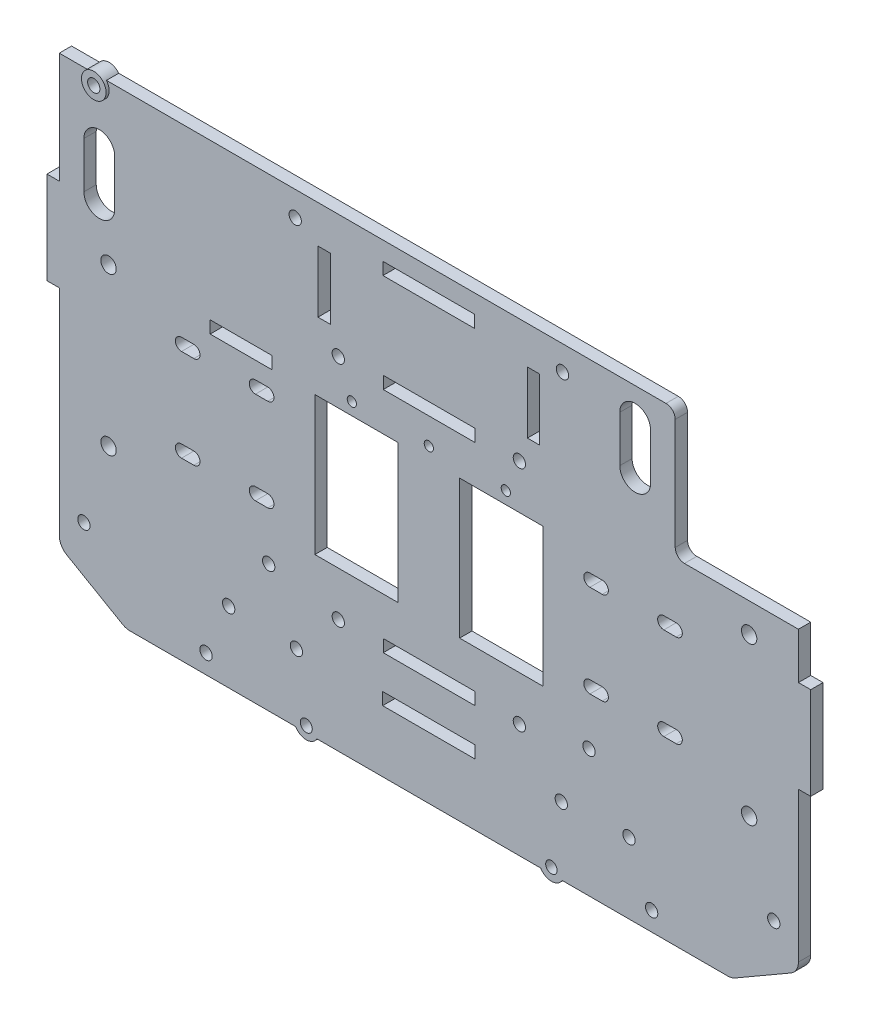
from build123d import *

# Parameters (mm, degrees)
SKETCH1_W           = 240
SKETCH1_H           = 151
BOSS_EXTRUDE1_DEPTH = 4
SKETCH2_W           = 27
SKETCH2_H           = 45
CUT_EXTRUDE1_DEPTH  = 10
CUT_EXTRUDE10_DEPTH = 5
SKETCH15_R          = 2.5
CUT_EXTRUDE11_DEPTH = 10
SKETCH27_R          = 1.5
CUT_EXTRUDE20_DEPTH = 10
SKETCH28_R          = 2
CUT_EXTRUDE21_DEPTH = 10
SKETCH31_R          = 2
CUT_EXTRUDE24_DEPTH = 10
SKETCH32_R          = 2
CUT_EXTRUDE25_DEPTH = 10
SKETCH34_W          = 40
SKETCH34_H          = 42
CUT_EXTRUDE26_DEPTH = 10
CUT_EXTRUDE28_DEPTH = 10
SKETCH39_R          = 2
CUT_EXTRUDE31_DEPTH = 5
SKETCH40_R          = 4
SKETCH40_R_2        = 2
BOSS_EXTRUDE6_DEPTH = 5
FILLET1_R           = 3
SKETCH43_W          = 4
SKETCH43_H          = 30
BOSS_EXTRUDE8_DEPTH = 4
FILLET2_R           = 3
CUT_EXTRUDE33_DEPTH = 10
FILLET4_R           = 5
CUT_EXTRUDE34_DEPTH = 5
SKETCH46_W          = 30
SKETCH46_H          = 4
SKETCH46_W_2        = 29.8
CUT_EXTRUDE35_DEPTH = 10
SKETCH47_R          = 2
CUT_EXTRUDE36_DEPTH = 10
SKETCH48_R          = 1.995
CUT_EXTRUDE37_DEPTH = 10
SKETCH49_R          = 4
SKETCH49_R_2        = 1.868109978
SKETCH49_R_3        = 1.95
BOSS_EXTRUDE9_DEPTH = 4
SKETCH50_W          = 20
SKETCH50_H          = 4
CUT_EXTRUDE38_DEPTH = 10
SKETCH51_W          = 4
SKETCH51_H          = 20
CUT_EXTRUDE39_DEPTH = 10


with BuildPart() as part:
    # Sketch1 → Boss-Extrude1 (new body)
    with BuildSketch(Plane.XY):
        Rectangle(SKETCH1_W, SKETCH1_H)
    extrude(amount=BOSS_EXTRUDE1_DEPTH)

    # Sketch2 → Cut-Extrude1 (cut)
    with BuildSketch(Plane(origin=(0, 0, 0), x_dir=(-1, 0, 0), z_dir=(0, 0, -1))):
        with Locations((23.5, -1.5)):
            Rectangle(SKETCH2_W, SKETCH2_H)
        with Locations((-23.5, -1.5)):
            Rectangle(SKETCH2_W, SKETCH2_H)
    extrude(amount=-CUT_EXTRUDE1_DEPTH, mode=Mode.SUBTRACT)

    # Sketch14 → Cut-Extrude10 (cut)
    with BuildSketch(Plane(origin=(0, 0, 0), x_dir=(-1, 0, 0), z_dir=(0, 0, -1))):
        with BuildLine():
            Line((-56.3, 15.46), (-52.3, 15.46))
            ThreePointArc((-52.3, 15.46), (-50.3, 13.46), (-52.3, 11.46))
            Line((-52.3, 11.46), (-56.3, 11.46))
            ThreePointArc((-56.3, 11.46), (-58.3, 13.46), (-56.3, 15.46))
        make_face()
        with BuildLine():
            Line((-80.3, 15.46), (-76.3, 15.46))
            ThreePointArc((-76.3, 15.46), (-74.3, 13.46), (-76.3, 11.46))
            Line((-76.3, 11.46), (-80.3, 11.46))
            ThreePointArc((-80.3, 11.46), (-82.3, 13.46), (-80.3, 15.46))
        make_face()
        with BuildLine():
            Line((-80.3, -14.54), (-76.3, -14.54))
            ThreePointArc((-76.3, -14.54), (-74.3, -16.54), (-76.3, -18.54))
            Line((-76.3, -18.54), (-80.3, -18.54))
            ThreePointArc((-80.3, -18.54), (-82.3, -16.54), (-80.3, -14.54))
        make_face()
        with BuildLine():
            Line((-56.3, -14.54), (-52.3, -14.54))
            ThreePointArc((-52.3, -14.54), (-50.3, -16.54), (-52.3, -18.54))
            Line((-52.3, -18.54), (-56.3, -18.54))
            ThreePointArc((-56.3, -18.54), (-58.3, -16.54), (-56.3, -14.54))
        make_face()
        with BuildLine():
            Line((56.3, -14.54), (52.3, -14.54))
            ThreePointArc((52.3, -14.54), (50.3, -16.54), (52.3, -18.54))
            Line((52.3, -18.54), (56.3, -18.54))
            ThreePointArc((56.3, -18.54), (58.3, -16.54), (56.3, -14.54))
        make_face()
        with BuildLine():
            Line((80.3, -14.54), (76.3, -14.54))
            ThreePointArc((76.3, -14.54), (74.3, -16.54), (76.3, -18.54))
            Line((76.3, -18.54), (80.3, -18.54))
            ThreePointArc((80.3, -18.54), (82.3, -16.54), (80.3, -14.54))
        make_face()
        with BuildLine():
            Line((80.3, 15.46), (76.3, 15.46))
            ThreePointArc((76.3, 15.46), (74.3, 13.46), (76.3, 11.46))
            Line((76.3, 11.46), (80.3, 11.46))
            ThreePointArc((80.3, 11.46), (82.3, 13.46), (80.3, 15.46))
        make_face()
        with BuildLine():
            Line((56.3, 15.46), (52.3, 15.46))
            ThreePointArc((52.3, 15.46), (50.3, 13.46), (52.3, 11.46))
            Line((52.3, 11.46), (56.3, 11.46))
            ThreePointArc((56.3, 11.46), (58.3, 13.46), (56.3, 15.46))
        make_face()
    extrude(amount=-CUT_EXTRUDE10_DEPTH, mode=Mode.SUBTRACT)

    # Sketch15 → Cut-Extrude11 (cut)
    with BuildSketch(Plane(origin=(0, 0, 0), x_dir=(-1, 0, 0), z_dir=(0, 0, -1))):
        with Locations((-104, -27)):
            Circle(SKETCH15_R)
        with Locations((-104, 24)):
            Circle(SKETCH15_R)
        with Locations(Location((104, 24, 0), (0, 0, 180))):
            Circle(SKETCH15_R)
        with Locations(Location((104, -27, 0), (0, 0, 180))):
            Circle(SKETCH15_R)
    extrude(amount=-CUT_EXTRUDE11_DEPTH, mode=Mode.SUBTRACT)

    # Sketch27 → Cut-Extrude20 (cut)
    with BuildSketch(Plane(origin=(0, 0, 0), x_dir=(-1, 0, 0), z_dir=(0, 0, -1))):
        with Locations((-25, 25)):
            Circle(SKETCH27_R)
        with Locations((0, 25)):
            Circle(SKETCH27_R)
        with Locations((25, 25)):
            Circle(SKETCH27_R)
    extrude(amount=-CUT_EXTRUDE20_DEPTH, mode=Mode.SUBTRACT)

    # Sketch28 → Cut-Extrude21 (cut)
    with BuildSketch(Plane.XY.offset(4)):
        with Locations((112, -52.5)):
            Circle(SKETCH28_R)
        with Locations((65, -52.5)):
            Circle(SKETCH28_R)
        with Locations((-65, -52.5)):
            Circle(SKETCH28_R)
        with Locations((-112, -52.5)):
            Circle(SKETCH28_R)
    extrude(amount=-CUT_EXTRUDE21_DEPTH, mode=Mode.SUBTRACT)

    # Sketch31 → Cut-Extrude24 (cut)
    with BuildSketch(Plane(origin=(0, 0, 0), x_dir=(-1, 0, 0), z_dir=(0, 0, -1))):
        with Locations((72.345744872, -69.339745962)):
            Circle(SKETCH31_R)
        with Locations(Location((-72.345744872, -69.339745962, 0), (0, 0, 180))):
            Circle(SKETCH31_R)
    extrude(amount=-CUT_EXTRUDE24_DEPTH, mode=Mode.SUBTRACT)

    # Sketch32 → Cut-Extrude25 (cut)
    with BuildSketch(Plane(origin=(0, 0, 0), x_dir=(-1, 0, 0), z_dir=(0, 0, -1))):
        with Locations((52.005844325, -34.1100048)):
            Circle(SKETCH32_R)
        with Locations(Location((-52.005844325, -34.1100048, 0), (0, 0, 180))):
            Circle(SKETCH32_R)
    extrude(amount=-CUT_EXTRUDE25_DEPTH, mode=Mode.SUBTRACT)

    # Sketch34 → Cut-Extrude26 (cut)
    with BuildSketch(Plane(origin=(0, 0, 0), x_dir=(-1, 0, 0), z_dir=(0, 0, -1))):
        with Locations((-100, 54.5)):
            Rectangle(SKETCH34_W, SKETCH34_H)
    extrude(amount=-CUT_EXTRUDE26_DEPTH, mode=Mode.SUBTRACT)

    # Sketch36 → Cut-Extrude28 (cut)
    with BuildSketch(Plane(origin=(0, 0, 0), x_dir=(-1, 0, 0), z_dir=(0, 0, -1))):
        with BuildLine():
            Line((102, 40.5), (102, 55.5))
            ThreePointArc((102, 55.5), (107, 60.5), (112, 55.5))
            Line((112, 55.5), (112, 40.5))
            ThreePointArc((112, 40.5), (107, 35.5), (102, 40.5))
        make_face()
    extrude(amount=-CUT_EXTRUDE28_DEPTH, mode=Mode.SUBTRACT)

    # Sketch39 → Cut-Extrude31 (cut)
    with BuildSketch(Plane(origin=(0, 0, 0), x_dir=(-1, 0, 0), z_dir=(0, 0, -1))):
        with Locations((107.8, 73)):
            Circle(SKETCH39_R)
    extrude(amount=-CUT_EXTRUDE31_DEPTH, mode=Mode.SUBTRACT)

    # Sketch40 → Boss-Extrude6 (add)
    with BuildSketch(Plane(origin=(0, 0, 0), x_dir=(-1, 0, 0), z_dir=(0, 0, -1))):
        with Locations((107.8, 73)):
            Circle(SKETCH40_R)
        with Locations((107.8, 73)):
            Circle(SKETCH40_R_2, mode=Mode.SUBTRACT)
    extrude(amount=-BOSS_EXTRUDE6_DEPTH)

    # Fillet1
    fillet1_edges = [part.edges().sort_by_distance(p)[0] for p in [
        (80, 33.5, 2),
    ]]
    fillet(fillet1_edges, radius=FILLET1_R)

    # Sketch43 → Boss-Extrude8 (add)
    with BuildSketch(Plane(origin=(0, 0, 0), x_dir=(-1, 0, 0), z_dir=(0, 0, -1))):
        with Locations((-122, 3.5)):
            Rectangle(SKETCH43_W, SKETCH43_H)
        with Locations((122, 24.5)):
            Rectangle(SKETCH43_W, SKETCH43_H)
    extrude(amount=-BOSS_EXTRUDE8_DEPTH)

    # Fillet2
    fillet2_edges = [part.edges().sort_by_distance(p)[0] for p in [
        (80, 75.5, 2),
    ]]
    fillet(fillet2_edges, radius=FILLET2_R)

    # Sketch44 → Cut-Extrude33 (cut)
    with BuildSketch(Plane(origin=(0, 0, 0), x_dir=(-1, 0, 0), z_dir=(0, 0, -1))):
        Polygon((-98.317208235, -75.501625548), (-120, -62.983059886), (-120, -75.5), align=None)
        Polygon((98.317208235, -75.501625548), (120, -62.983059886), (120, -75.5), align=None)
    extrude(amount=-CUT_EXTRUDE33_DEPTH, mode=Mode.SUBTRACT)

    # Fillet4
    fillet4_edges = [part.edges().sort_by_distance(p)[0] for p in [
        (98.320023767, -75.5, 2),
        (120, -62.983059886, 2),
        (-98.320023767, -75.5, 2),
        (-120, -62.983059886, 2),
    ]]
    fillet(fillet4_edges, radius=FILLET4_R)

    # Sketch45 → Cut-Extrude34 (cut)
    with BuildSketch(Plane(origin=(0, 0, 0), x_dir=(-1, 0, 0), z_dir=(0, 0, -1))):
        with BuildLine():
            Line((-62, 65.5), (-62, 50.5))
            ThreePointArc((-62, 50.5), (-67, 45.5), (-72, 50.5))
            Line((-72, 50.5), (-72, 65.5))
            ThreePointArc((-72, 65.5), (-67, 70.5), (-62, 65.5))
        make_face()
    extrude(amount=-CUT_EXTRUDE34_DEPTH, mode=Mode.SUBTRACT)

    # Sketch46 → Cut-Extrude35 (cut)
    with BuildSketch(Plane(origin=(0, 0, 0), x_dir=(-1, 0, 0), z_dir=(0, 0, -1))):
        with Locations((0, -53.5)):
            Rectangle(SKETCH46_W, SKETCH46_H)
        with Locations((-0.1, -38.5)):
            Rectangle(SKETCH46_W_2, SKETCH46_H)
        with Locations((-0.1, 35.5)):
            Rectangle(SKETCH46_W_2, SKETCH46_H)
        with Locations((0, 67.5)):
            Rectangle(SKETCH46_W_2, SKETCH46_H)
    extrude(amount=-CUT_EXTRUDE35_DEPTH, mode=Mode.SUBTRACT)

    # Sketch47 → Cut-Extrude36 (cut)
    with BuildSketch(Plane(origin=(0, 0, 0), x_dir=(-1, 0, 0), z_dir=(0, 0, -1))):
        with Locations((29.39999999, 35.5)):
            Circle(SKETCH47_R)
        with Locations((-29.39999999, 35.5)):
            Circle(SKETCH47_R)
        with Locations((-43.4, 67.5)):
            Circle(SKETCH47_R)
        with Locations((43.4, 67.5)):
            Circle(SKETCH47_R)
        with Locations((29.39999999, -38.5)):
            Circle(SKETCH47_R)
        with Locations((-29.39999999, -38.5)):
            Circle(SKETCH47_R)
        with Locations((43, -53.5)):
            Circle(SKETCH47_R)
        with Locations((-43, -53.5)):
            Circle(SKETCH47_R)
    extrude(amount=-CUT_EXTRUDE36_DEPTH, mode=Mode.SUBTRACT)

    # Sketch48 → Cut-Extrude37 (cut)
    with BuildSketch(Plane(origin=(0, 0, 0), x_dir=(-1, 0, 0), z_dir=(0, 0, -1))):
        with Locations((-39.8, -73.5)):
            Circle(SKETCH48_R)
        with Locations((39.8, -73.5)):
            Circle(SKETCH48_R)
    extrude(amount=-CUT_EXTRUDE37_DEPTH, mode=Mode.SUBTRACT)

    # Sketch49 → Boss-Extrude9 (add)
    # profile 1 of 2: a face of its own
    with BuildSketch(Plane(origin=(0, 0, 0), x_dir=(-1, 0, 0), z_dir=(0, 0, -1))):
        with Locations((-39.8, -73.5)):
            Circle(SKETCH49_R)
        with Locations((-39.8, -73.5)):
            Circle(SKETCH49_R_2, mode=Mode.SUBTRACT)
    # profile 2 of 2: a face of its own
    with BuildSketch(Plane(origin=(0, 0, 0), x_dir=(-1, 0, 0), z_dir=(0, 0, -1))):
        with Locations((39.8, -73.5)):
            Circle(SKETCH49_R)
        with Locations((39.8, -73.5)):
            Circle(SKETCH49_R_3, mode=Mode.SUBTRACT)
    extrude(amount=-BOSS_EXTRUDE9_DEPTH)

    # Sketch50 → Cut-Extrude38 (cut)
    with BuildSketch(Plane.XY.offset(4)):
        with Locations((-61, 23)):
            Rectangle(SKETCH50_W, SKETCH50_H)
    extrude(amount=-CUT_EXTRUDE38_DEPTH, mode=Mode.SUBTRACT)

    # Sketch51 → Cut-Extrude39 (cut)
    with BuildSketch(Plane(origin=(0, 0, 0), x_dir=(-1, 0, 0), z_dir=(0, 0, -1))):
        with Locations((-34, 53.25)):
            Rectangle(SKETCH51_W, SKETCH51_H)
        with Locations((34, 53.25)):
            Rectangle(SKETCH51_W, SKETCH51_H)
    extrude(amount=-CUT_EXTRUDE39_DEPTH, mode=Mode.SUBTRACT)


solid = part.part
